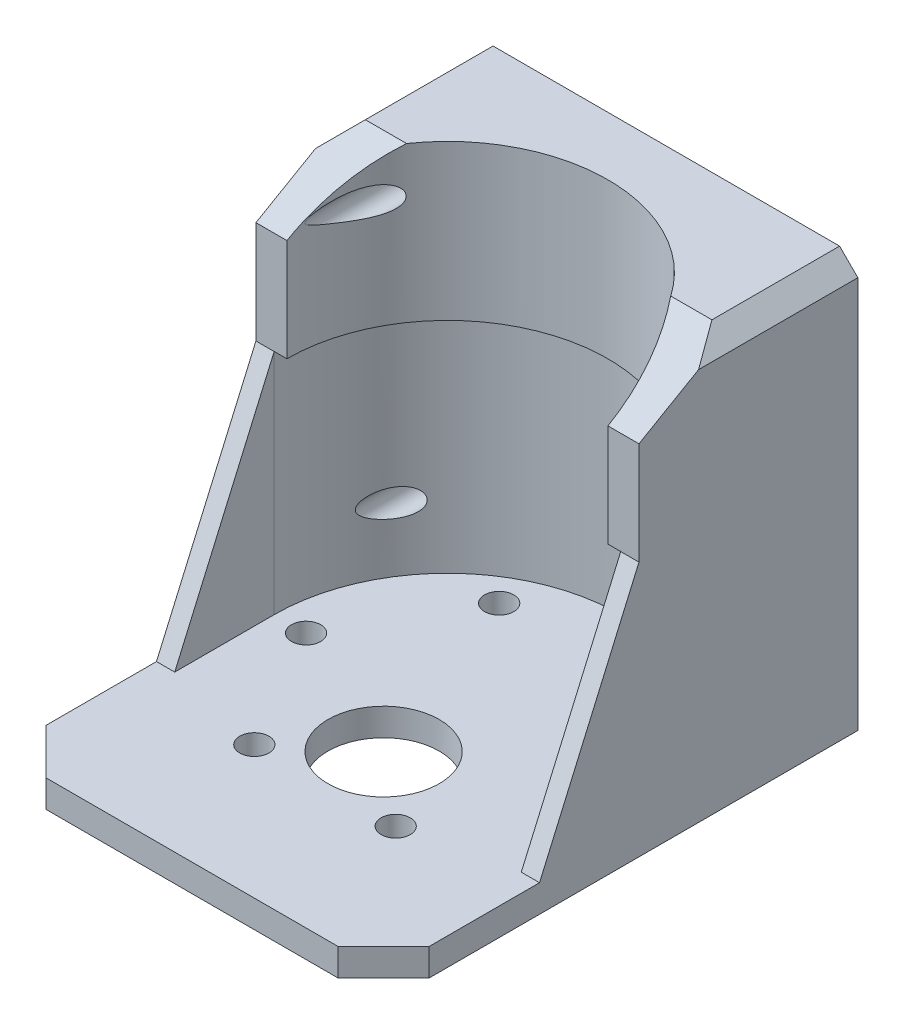
from build123d import *

# Parameters (mm, degrees)
SKETCH_2_R          = 1.5
EXTRUDE_1_DEPTH     = 52
CUT_EXTRUDE_START   = -3
SKETCH_3_R          = 19
SKETCH_3_R_2        = 1.6
CUT_EXTRUDE_1_DEPTH = 25
SKETCH_3_3_R        = 1.6
CUT_EXTRUDE_2_DEPTH = 25
SKETCH_5_R          = 17.6
CUT_EXTRUDE_3_DEPTH = 310.300460798
SKETCH_6_R          = 6.1
CUT_EXTRUDE_4_DEPTH = 3
CUT_EXTRUDE_5_REACH = 313.3
SKETCH_7_W          = 42
SKETCH_7_H          = 28
CHAMFER_1_SIZE      = 5
CHAMFER_5_SIZE      = 10
CHAMFER_5_SIZE2     = 5.773502692
EXTRUDE_2_DEPTH     = 2


with BuildPart() as part:
    # 草图2 → 凸台-拉伸1 (new body)
    with BuildSketch(Plane(origin=(0, 0, 255.313805399), x_dir=(-1, 0, 0), z_dir=(0, 0, -1))):
        Polygon((21, 18), (19, 20), (-19, 20), (-21, 18), (-21, -25), (21, -25), align=None)
        with Locations((16, -15)):
            Circle(SKETCH_2_R, mode=Mode.SUBTRACT)
        with Locations((16, 15)):
            Circle(SKETCH_2_R, mode=Mode.SUBTRACT)
        with Locations((-16, 15)):
            Circle(SKETCH_2_R, mode=Mode.SUBTRACT)
        with Locations((-16, -15)):
            Circle(SKETCH_2_R, mode=Mode.SUBTRACT)
    extrude(amount=-EXTRUDE_1_DEPTH)

    # 草图3 → 切除-拉伸1 (cut)
    # profile 1 of 7: a face of its own
    with BuildSketch(Plane.XZ.offset(25).offset(CUT_EXTRUDE_START)):
        with Locations(Location((0, 279.313805399, 0), (0, 0, 270))):
            Circle(SKETCH_3_R)
        with Locations((15.5, 279.313805399)):
            Circle(SKETCH_3_R_2, mode=Mode.SUBTRACT)
        with Locations((7.75, 292.737199157)):
            Circle(SKETCH_3_R_2, mode=Mode.SUBTRACT)
        with Locations((-7.75, 292.737199157)):
            Circle(SKETCH_3_R_2, mode=Mode.SUBTRACT)
        with Locations((-15.5, 279.313805399)):
            Circle(SKETCH_3_R_2, mode=Mode.SUBTRACT)
        with Locations((-7.75, 265.89041164)):
            Circle(SKETCH_3_R_2, mode=Mode.SUBTRACT)
        with Locations((7.75, 265.89041164)):
            Circle(SKETCH_3_R_2, mode=Mode.SUBTRACT)
    # profile 2 of 7: a face of its own
    with BuildSketch(Plane.XZ.offset(25).offset(CUT_EXTRUDE_START)):
        with Locations((7.75, 292.737199157)):
            Circle(SKETCH_3_R_2)
    # profile 3 of 7: a face of its own
    with BuildSketch(Plane.XZ.offset(25).offset(CUT_EXTRUDE_START)):
        with Locations((-7.75, 292.737199157)):
            Circle(SKETCH_3_R_2)
    # profile 4 of 7: a face of its own
    with BuildSketch(Plane.XZ.offset(25).offset(CUT_EXTRUDE_START)):
        with Locations((-15.5, 279.313805399)):
            Circle(SKETCH_3_R_2)
    # profile 5 of 7: a face of its own
    with BuildSketch(Plane.XZ.offset(25).offset(CUT_EXTRUDE_START)):
        with Locations((-7.75, 265.89041164)):
            Circle(SKETCH_3_R_2)
    # profile 6 of 7: a face of its own
    with BuildSketch(Plane.XZ.offset(25).offset(CUT_EXTRUDE_START)):
        with Locations((7.75, 265.89041164)):
            Circle(SKETCH_3_R_2)
    # profile 7 of 7: a face of its own
    with BuildSketch(Plane.XZ.offset(25).offset(CUT_EXTRUDE_START)):
        with Locations((15.5, 279.313805399)):
            Circle(SKETCH_3_R_2)
    extrude(amount=-CUT_EXTRUDE_1_DEPTH, mode=Mode.SUBTRACT)

    # 草图3<3> → 切除-拉伸2 (cut)
    with BuildSketch(Plane.XZ.offset(25)):
        with Locations(Location((-7.75, 292.737199157, 0), (0, 0, 270))):
            Circle(SKETCH_3_3_R)
        with Locations(Location((7.75, 292.737199157, 0), (0, 0, 270))):
            Circle(SKETCH_3_3_R)
        with Locations(Location((-15.5, 279.313805399, 0), (0, 0, 270))):
            Circle(SKETCH_3_3_R)
        with Locations(Location((-7.75, 265.89041164, 0), (0, 0, 270))):
            Circle(SKETCH_3_3_R)
        with Locations(Location((7.75, 265.89041164, 0), (0, 0, 270))):
            Circle(SKETCH_3_3_R)
        with Locations(Location((15.5, 279.313805399, 0), (0, 0, 270))):
            Circle(SKETCH_3_3_R)
    extrude(amount=-CUT_EXTRUDE_2_DEPTH, mode=Mode.SUBTRACT)

    # 草图5 → 切除-拉伸3 (cut, through all)
    with BuildSketch(Plane.XZ.offset(-3)):
        with Locations(Location((0, 279.313805399, 0), (0, 0, 270))):
            Circle(SKETCH_5_R)
    extrude(amount=-CUT_EXTRUDE_3_DEPTH, mode=Mode.SUBTRACT)

    # 草图6 → 切除-拉伸4 (cut)
    with BuildSketch(Plane.XZ.offset(25)):
        with Locations(Location((0, 286.313805399, 0), (0, 0, 270))):
            Circle(SKETCH_6_R)
    extrude(amount=-CUT_EXTRUDE_4_DEPTH, mode=Mode.SUBTRACT)

    # 切除-拉伸5: up to this face of the body (flat: up to its plane)
    cut_extrude_5_end = Plane(part.part.faces().sort_by_distance((0, -22, 278.469302594))[0])
    # 草图7 → 切除-拉伸5 (cut, up to the picked face)
    with BuildSketch(Plane(origin=(0, 20, 0), x_dir=(1, 0, 0), z_dir=(0, 1, 0)), mode=Mode.PRIVATE) as cut_extrude_5_sk1:
        with Locations((0, -293.313805399)):
            Rectangle(SKETCH_7_W, SKETCH_7_H)
    cut_extrude_5_tool1 = split(extrude(cut_extrude_5_sk1.sketch, amount=-CUT_EXTRUDE_5_REACH, mode=Mode.PRIVATE), bisect_by=cut_extrude_5_end, keep=Keep.BOTH, mode=Mode.PRIVATE)
    add(cut_extrude_5_tool1.solids().sort_by(Axis((0, 20, 293.313805), (0, -1, 0)))[0], mode=Mode.SUBTRACT)

    # 倒角1
    chamfer_1_edges = [part.edges().sort_by_distance(p)[0] for p in [
        (21, -23.5, 307.313805399),
        (-21, -23.5, 307.313805399),
    ]]
    chamfer(chamfer_1_edges, length=CHAMFER_1_SIZE)

    # 倒角5
    chamfer_5_edges = [part.edges().sort_by_distance(p)[0] for p in [
        (-18.3, 20, 279.313805399),
        (18.3, 20, 279.313805399),
    ]]
    chamfer_5_side = [part.faces().sort_by_distance(p)[0] for p in [
        (0, 20, 255.7632495),
    ]]
    chamfer(chamfer_5_edges, length=CHAMFER_5_SIZE, length2=CHAMFER_5_SIZE2, reference=chamfer_5_side[0])

    # 草图8 → 凸台-拉伸2 (add)
    with BuildSketch(Plane(origin=(21, 0, 0), x_dir=(0, 0, -1), z_dir=(1, 0, 0))):
        Polygon((-279.313805399, -22), (-279.313805399, 2.989978389), (-290.216930942, -22), align=None)
    extrude_2 = extrude(amount=-EXTRUDE_2_DEPTH)

    # 镜向1: 凸台-拉伸2 across plane
    add(extrude_2.mirror(Plane(origin=(0, 0, 0), x_dir=(0, 0, 1), z_dir=(1, 0, 0))))


solid = part.part
